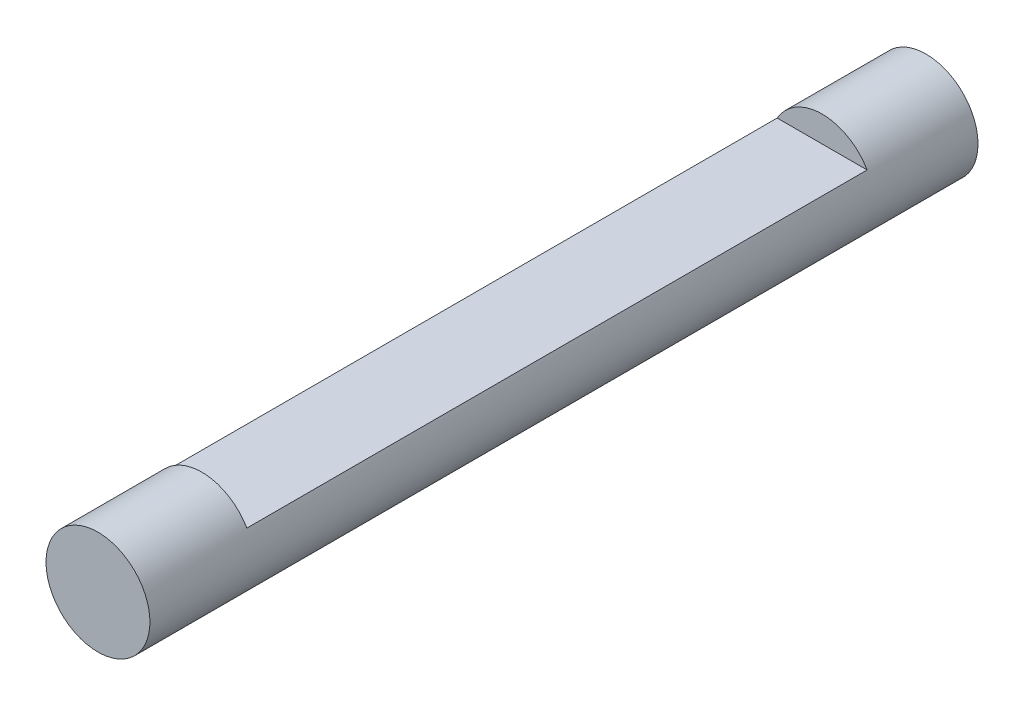
from build123d import *

# Parameters (mm, degrees)
SKETCH1_R           = 4
BOSS_EXTRUDE1_DEPTH = 63.76
SKETCH2_W           = 8
SKETCH2_H           = 47.76
CUT_EXTRUDE1_DEPTH  = 65.166483463


with BuildPart() as part:
    # Sketch1 → Boss-Extrude1 (new body)
    with BuildSketch(Plane.XY):
        with Locations(Location((0, 0, 0), (0, 0, 180))):
            Circle(SKETCH1_R)
    extrude(amount=BOSS_EXTRUDE1_DEPTH)

    # Sketch2 → Cut-Extrude1 (cut, through all)
    with BuildSketch(Plane(origin=(0, 2, 0), x_dir=(1, 0, 0), z_dir=(0, 1, 0))):
        with Locations((0, -31.88)):
            Rectangle(SKETCH2_W, SKETCH2_H)
    extrude(amount=CUT_EXTRUDE1_DEPTH, mode=Mode.SUBTRACT)


solid = part.part
